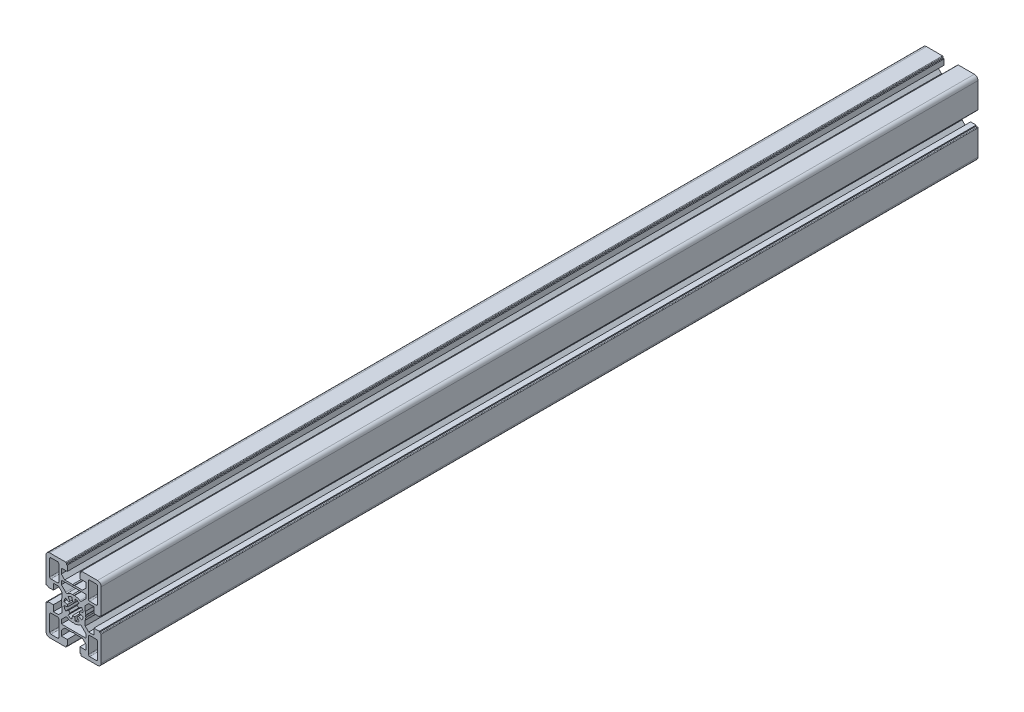
from build123d import *

# Parameters (mm, degrees)
EXTRUDE_1_DEPTH = 715


with BuildPart() as part:
    # Model → Бобышка-Вытянуть1 (new body)
    with BuildSketch(Plane.XY):
        with BuildLine():
            Line((22.499940818, 6.45), (22.499940818, 27))
            ThreePointArc((22.499940818, 27), (21.621261161, 29.121320344), (19.499940818, 30))
            Line((19.499940818, 30), (6.449941444, 30))
            ThreePointArc((6.449941444, 30), (6.09638761, 29.853553207), (5.949940818, 29.499999374))
            Line((5.949940818, 29.499999374), (5.949940818, 28.500009854))
            Line((5.949940818, 28.500009854), (5.149940818, 28.500009854))
            Line((5.149940818, 28.500009854), (5.149940818, 23.999879571))
            Line((5.149940818, 23.999879571), (10.049891448, 23.999879571))
            Line((10.049891448, 23.999879571), (10.049891448, 19.799919875))
            Line((10.049891448, 19.799919875), (7.249986913, 17.00001134))
            Line((7.249986913, 17.00001134), (0.809162269, 17.00001134))
            Line((0.809162269, 17.00001134), (-5.9182e-05, 16.532807117))
            Line((-5.9182e-05, 16.532807117), (-0.809280634, 17.00001134))
            Line((-0.809280634, 17.00001134), (-7.250105277, 17.00001134))
            Line((-7.250105277, 17.00001134), (-10.050070277, 19.79998034))
            Line((-10.050070277, 19.79998034), (-10.050070277, 23.999879571))
            Line((-10.050070277, 23.999879571), (-5.150059182, 23.999879571))
            Line((-5.150059182, 23.999879571), (-5.150059182, 28.500009854))
            Line((-5.150059182, 28.500009854), (-5.950059182, 28.500009854))
            Line((-5.950059182, 28.500009854), (-5.950059182, 29.499999374))
            ThreePointArc((-5.950059182, 29.499999374), (-6.096505975, 29.853553207), (-6.450059809, 30))
            Line((-6.450059809, 30), (-19.500058302, 30))
            ThreePointArc((-19.500058302, 30), (-21.621379268, 29.121320086), (-22.500059182, 26.99999912))
            Line((-22.500059182, 26.99999912), (-22.500059182, 6.45))
            ThreePointArc((-22.500059182, 6.45), (-22.353612573, 6.096446609), (-22.000059182, 5.95))
            Line((-22.000059182, 5.95), (-21.000238688, 5.95))
            Line((-21.000238688, 5.95), (-21.000238688, 5.15))
            Line((-21.000238688, 5.15), (-16.500108405, 5.15))
            Line((-16.500108405, 5.15), (-16.500108405, 10.049991716))
            Line((-16.500108405, 10.049991716), (-12.3001436, 10.049991716))
            Line((-12.3001436, 10.049991716), (-9.500095405, 7.249945521))
            Line((-9.500095405, 7.249945521), (-9.500095405, 3.122515521))
            ThreePointArc((-9.500095405, 3.122515521), (-9.802174319, 1.979738875), (-9.967299419, 0.809301419))
            Line((-9.967299419, 0.809301419), (-9.500049669, 9.3e-07))
            Line((-9.500049669, 9.3e-07), (-9.967299577, -0.809299467))
            ThreePointArc((-9.967299577, -0.809299467), (-9.802174513, -1.979737915), (-9.500095405, -3.122515521))
            Line((-9.500095405, -3.122515521), (-9.500095405, -7.249945521))
            Line((-9.500095405, -7.249945521), (-12.300138405, -10.049986521))
            Line((-12.300138405, -10.049986521), (-16.500108405, -10.049986521))
            Line((-16.500108405, -10.049986521), (-16.500108405, -5.15))
            Line((-16.500108405, -5.15), (-21.000238688, -5.15))
            Line((-21.000238688, -5.15), (-21.000238688, -5.95))
            Line((-21.000238688, -5.95), (-22.000059182, -5.95))
            ThreePointArc((-22.000059182, -5.95), (-22.353612573, -6.096446609), (-22.500059182, -6.45))
            Line((-22.500059182, -6.45), (-22.500059182, -27.000002241))
            ThreePointArc((-22.500059182, -27.000002241), (-21.621380182, -29.121321), (-19.500061424, -30))
            Line((-19.500061424, -30), (-6.450059809, -30))
            ThreePointArc((-6.450059809, -30), (-6.096505975, -29.853553207), (-5.950059182, -29.499999374))
            Line((-5.950059182, -29.499999374), (-5.950059182, -28.500009854))
            Line((-5.950059182, -28.500009854), (-5.150059182, -28.500009854))
            Line((-5.150059182, -28.500009854), (-5.150059182, -23.999879571))
            Line((-5.150059182, -23.999879571), (-10.050070277, -23.999879571))
            Line((-10.050070277, -23.999879571), (-10.050070277, -19.79998034))
            Line((-10.050070277, -19.79998034), (-7.250105277, -17.00001134))
            Line((-7.250105277, -17.00001134), (-0.809280634, -17.00001134))
            Line((-0.809280634, -17.00001134), (-5.9182e-05, -16.532807117))
            Line((-5.9182e-05, -16.532807117), (0.809162269, -17.00001134))
            Line((0.809162269, -17.00001134), (7.249986913, -17.00001134))
            Line((7.249986913, -17.00001134), (10.049891448, -19.799919875))
            Line((10.049891448, -19.799919875), (10.049891448, -23.999879571))
            Line((10.049891448, -23.999879571), (5.149940818, -23.999879571))
            Line((5.149940818, -23.999879571), (5.149940818, -28.500009854))
            Line((5.149940818, -28.500009854), (5.949940818, -28.500009854))
            Line((5.949940818, -28.500009854), (5.949940818, -29.499999374))
            ThreePointArc((5.949940818, -29.499999374), (6.09638761, -29.853553207), (6.449941444, -30))
            Line((6.449941444, -30), (19.499943059, -30))
            ThreePointArc((19.499943059, -30), (21.621261818, -29.121321), (22.499940818, -27.000002241))
            Line((22.499940818, -27.000002241), (22.499940818, -6.45))
            ThreePointArc((22.499940818, -6.45), (22.353494208, -6.096446609), (21.999940818, -5.95))
            Line((21.999940818, -5.95), (21.000120323, -5.95))
            Line((21.000120323, -5.95), (21.000120323, -5.15))
            Line((21.000120323, -5.15), (16.49999004, -5.15))
            Line((16.49999004, -5.15), (16.49999004, -10.049986521))
            Line((16.49999004, -10.049986521), (12.30002004, -10.049986521))
            Line((12.30002004, -10.049986521), (9.499979047, -7.249947528))
            Line((9.499979047, -7.249947528), (9.499979047, -3.122509416))
            ThreePointArc((9.499979047, -3.122509416), (9.802056784, -1.979734765), (9.967181212, -0.809299467))
            Line((9.967181212, -0.809299467), (9.499931304, 9.3e-07))
            Line((9.499931304, 9.3e-07), (9.967181054, 0.809301419))
            ThreePointArc((9.967181054, 0.809301419), (9.80205659, 1.979735725), (9.499979047, 3.122509416))
            Line((9.499979047, 3.122509416), (9.499979047, 7.249947528))
            Line((9.499979047, 7.249947528), (12.300025235, 10.049991716))
            Line((12.300025235, 10.049991716), (16.49999004, 10.049991716))
            Line((16.49999004, 10.049991716), (16.49999004, 5.15))
            Line((16.49999004, 5.15), (21.000120323, 5.15))
            Line((21.000120323, 5.15), (21.000120323, 5.95))
            Line((21.000120323, 5.95), (21.999940818, 5.95))
            ThreePointArc((21.999940818, 5.95), (22.353494208, 6.096446609), (22.499940818, 6.45))
        make_face()
        with BuildLine():
            Line((-12.050088182, -13.050009591), (-12.050088182, -26.000012085))
            ThreePointArc((-12.050088182, -26.000012085), (-12.342981182, -26.707118338), (-13.050087435, -27.000011338))
            Line((-13.050087435, -27.000011338), (-18.50005893, -27.000011338))
            ThreePointArc((-18.50005893, -27.000011338), (-19.207165182, -26.707118338), (-19.500058182, -26.000012085))
            Line((-19.500058182, -26.000012085), (-19.500058182, -13.050009591))
            ThreePointArc((-19.500058182, -13.050009591), (-19.207165182, -12.342903338), (-18.50005893, -12.050010338))
            Line((-18.50005893, -12.050010338), (-13.050087435, -12.050010338))
            ThreePointArc((-13.050087435, -12.050010338), (-12.342981182, -12.342903338), (-12.050088182, -13.050009591))
        make_face(mode=Mode.SUBTRACT)
        with BuildLine():
            Line((-1.389241152, 7.878489936), (-0.868294995, 4.92403966))
            ThreePointArc((-0.868294995, 4.92403966), (-5.0744e-05, 5), (0.86819325, 4.924036729))
            Line((0.86819325, 4.924036729), (1.389149379, 7.878485247))
            ThreePointArc((1.389149379, 7.878485247), (3.061428001, 7.391057193), (4.588569097, 6.553237423))
            Line((4.588569097, 6.553237423), (2.867823853, 4.095759624))
            ThreePointArc((2.867823853, 4.095759624), (3.535474602, 3.535534027), (4.095700244, 2.867883316))
            Line((4.095700244, 2.867883316), (6.553177926, 4.588628729))
            ThreePointArc((6.553177926, 4.588628729), (7.391001137, 3.061479635), (7.878428997, 1.38919193))
            Line((7.878428997, 1.38919193), (4.92397938, 0.868242038))
            ThreePointArc((4.92397938, 0.868242038), (4.999940818, -7.38e-07), (4.923979123, -0.868243492))
            Line((4.923979123, -0.868243492), (7.878428587, -1.389194256))
            ThreePointArc((7.878428587, -1.389194256), (7.39099959, -3.061483372), (6.553174641, -4.58863342))
            Line((6.553174641, -4.58863342), (4.095698191, -2.867886249))
            ThreePointArc((4.095698191, -2.867886249), (3.535474877, -3.535533752), (2.867827422, -4.095757124))
            Line((2.867827422, -4.095757124), (4.588574808, -6.553233424))
            ThreePointArc((4.588574808, -6.553233424), (3.061418919, -7.391060955), (1.389123152, -7.878489871))
            Line((1.389123152, -7.878489871), (0.868176858, -4.92403962))
            ThreePointArc((0.868176858, -4.92403962), (-6.0279e-05, -5), (-0.868297383, -4.924039239))
            Line((-0.868297383, -4.924039239), (-1.389244972, -7.878489262))
            ThreePointArc((-1.389244972, -7.878489262), (-3.061535284, -7.391061784), (-4.588686752, -6.55323792))
            Line((-4.588686752, -6.55323792), (-2.867941775, -4.095759934))
            ThreePointArc((-2.867941775, -4.095759934), (-3.535595886, -3.535531109), (-4.095823655, -2.867876111))
            Line((-4.095823655, -2.867876111), (-6.553293644, -4.588632508))
            ThreePointArc((-6.553293644, -4.588632508), (-7.391117832, -3.061483668), (-7.878546647, -1.389195983))
            Line((-7.878546647, -1.389195983), (-4.924097298, -0.868244571))
            ThreePointArc((-4.924097298, -0.868244571), (-5.000059182, -4.4e-07), (-4.924097451, 0.868243706))
            Line((-4.924097451, 0.868243706), (-7.878546891, 1.389194598))
            ThreePointArc((-7.878546891, 1.389194598), (-7.3911174, 3.061484711), (-6.553291542, 4.588635511))
            Line((-6.553291542, 4.588635511), (-4.095815641, 2.867887555))
            ThreePointArc((-4.095815641, 2.867887555), (-3.535590587, 3.535536407), (-2.867940943, 4.095760517))
            Line((-2.867940943, 4.095760517), (-4.588685421, 6.553238852))
            ThreePointArc((-4.588685421, 6.553238852), (-3.061532741, 7.391062837), (-1.389241152, 7.878489936))
        make_face(mode=Mode.SUBTRACT)
        with BuildLine():
            Line((-12.050088182, 25.999989409), (-12.050088182, 13.049986915))
            ThreePointArc((-12.050088182, 13.049986915), (-12.342981182, 12.342880662), (-13.050087435, 12.049987662))
            Line((-13.050087435, 12.049987662), (-18.50005893, 12.049987662))
            ThreePointArc((-18.50005893, 12.049987662), (-19.207165182, 12.342880662), (-19.500058182, 13.049986915))
            Line((-19.500058182, 13.049986915), (-19.500058182, 25.999989409))
            ThreePointArc((-19.500058182, 25.999989409), (-19.207165182, 26.707095662), (-18.50005893, 26.999988662))
            Line((-18.50005893, 26.999988662), (-13.050087435, 26.999988662))
            ThreePointArc((-13.050087435, 26.999988662), (-12.342981182, 26.707095662), (-12.050088182, 25.999989409))
        make_face(mode=Mode.SUBTRACT)
        with BuildLine():
            Line((0.809162269, 9.967194709), (-5.9182e-05, 9.499990486))
            Line((-5.9182e-05, 9.499990486), (-0.809280634, 9.967194709))
            ThreePointArc((-0.809280634, 9.967194709), (-3.083702323, 9.512673373), (-5.192236534, 8.546408841))
            ThreePointArc((-5.192236534, 8.546408841), (-5.830899043, 8.408209885), (-6.418559808, 8.693943287))
            Line((-6.418559808, 8.693943287), (-10.000059182, 12.275439662))
            Line((-10.000059182, 12.275439662), (-10.000059182, 15.499951338))
            Line((-10.000059182, 15.499951338), (9.999940818, 15.499951338))
            Line((9.999940818, 15.499951338), (9.999940818, 12.275439662))
            Line((9.999940818, 12.275439662), (6.418441443, 8.693943287))
            ThreePointArc((6.418441443, 8.693943287), (5.830780678, 8.408209885), (5.192118169, 8.546408841))
            ThreePointArc((5.192118169, 8.546408841), (3.083583958, 9.512673373), (0.809162269, 9.967194709))
        make_face(mode=Mode.SUBTRACT)
        with BuildLine():
            Line((13.04997107, 26.999988662), (18.499942565, 26.999988662))
            ThreePointArc((18.499942565, 26.999988662), (19.207048818, 26.707095662), (19.499941818, 25.999989409))
            Line((19.499941818, 25.999989409), (19.499941818, 13.049986915))
            ThreePointArc((19.499941818, 13.049986915), (19.207048818, 12.342880662), (18.499942565, 12.049987662))
            Line((18.499942565, 12.049987662), (13.04997107, 12.049987662))
            ThreePointArc((13.04997107, 12.049987662), (12.342864818, 12.342880662), (12.049971818, 13.049986915))
            Line((12.049971818, 13.049986915), (12.049971818, 25.999989409))
            ThreePointArc((12.049971818, 25.999989409), (12.342864818, 26.707095662), (13.04997107, 26.999988662))
        make_face(mode=Mode.SUBTRACT)
        with BuildLine():
            Line((6.418441443, -8.693943287), (9.999940818, -12.275439662))
            Line((9.999940818, -12.275439662), (9.999940818, -15.499951338))
            Line((9.999940818, -15.499951338), (-10.000059182, -15.499951338))
            Line((-10.000059182, -15.499951338), (-10.000059182, -12.275439662))
            Line((-10.000059182, -12.275439662), (-6.418559808, -8.693943287))
            ThreePointArc((-6.418559808, -8.693943287), (-5.830899043, -8.408209885), (-5.192236534, -8.546408841))
            ThreePointArc((-5.192236534, -8.546408841), (-3.083702323, -9.512673373), (-0.809280634, -9.967194709))
            Line((-0.809280634, -9.967194709), (-5.9182e-05, -9.499990486))
            Line((-5.9182e-05, -9.499990486), (0.809162269, -9.967194709))
            ThreePointArc((0.809162269, -9.967194709), (3.083583958, -9.512673373), (5.192118169, -8.546408841))
            ThreePointArc((5.192118169, -8.546408841), (5.830780678, -8.408209885), (6.418441443, -8.693943287))
        make_face(mode=Mode.SUBTRACT)
        with BuildLine():
            Line((19.499941818, -13.050009591), (19.499941818, -26.000012085))
            ThreePointArc((19.499941818, -26.000012085), (19.207048818, -26.707118338), (18.499942565, -27.000011338))
            Line((18.499942565, -27.000011338), (13.04997107, -27.000011338))
            ThreePointArc((13.04997107, -27.000011338), (12.342864818, -26.707118338), (12.049971818, -26.000012085))
            Line((12.049971818, -26.000012085), (12.049971818, -13.050009591))
            ThreePointArc((12.049971818, -13.050009591), (12.342864818, -12.342903338), (13.04997107, -12.050010338))
            Line((13.04997107, -12.050010338), (18.499942565, -12.050010338))
            ThreePointArc((18.499942565, -12.050010338), (19.207048818, -12.342903338), (19.499941818, -13.050009591))
        make_face(mode=Mode.SUBTRACT)
    extrude(amount=EXTRUDE_1_DEPTH)


solid = part.part
